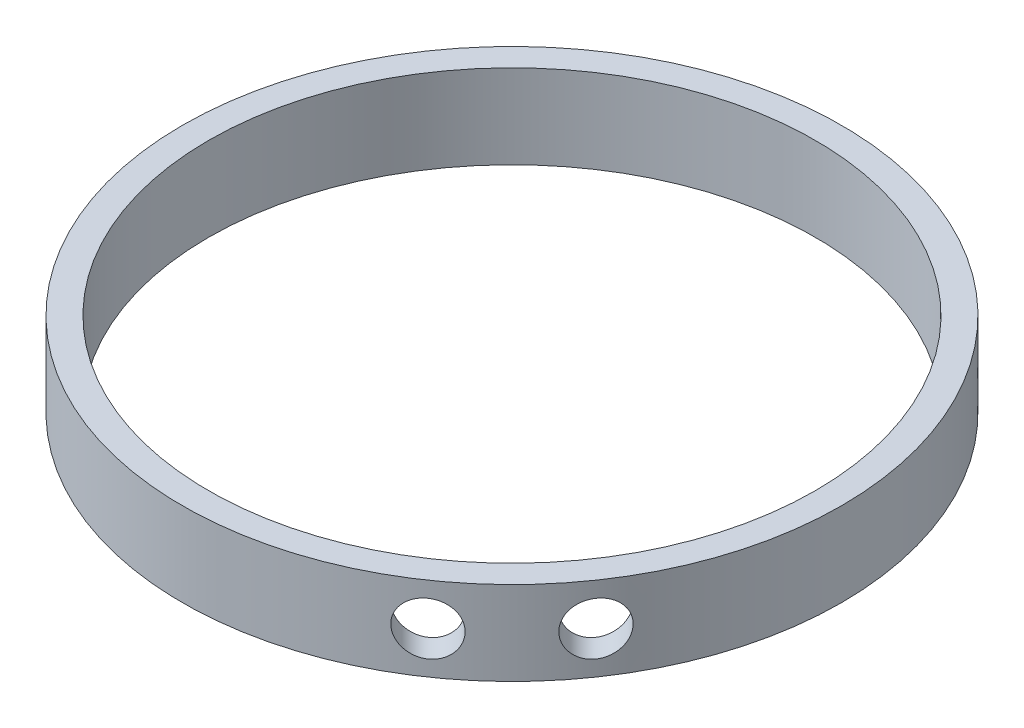
from build123d import *

# Parameters (mm, degrees)
SKETCH2_R                    = 7.9375
SKETCH2_R_2                  = 3.7465
BOSS_EXTRUDE1_DEPTH          = 204.47
FILLET1_R                    = 3.81
CIRPATTERN1_COUNT            = 4
FILLET1_OF_CIRPATTERN1_R     = 3.81
SKETCH3_R                    = 8.636
CUT_EXTRUDE1_DEPTH           = 12.7
CIRPATTERN2_COUNT            = 4
FILLET2_R                    = 2.54
MIRROR1_COPY_1_SKETCH_R      = 8.636
MIRROR1_COPY_1_DEPTH         = 12.7
MIRROR1_COPY_2_SKETCH_R      = 8.636
MIRROR1_COPY_2_DEPTH         = 12.7
MIRROR1_COPY_3_SKETCH_R      = 8.636
MIRROR1_COPY_3_DEPTH         = 12.7
FILLET3_R                    = 2.54
F_5_16_CLEARANCE_HOLE1_D     = 8.4328
F_5_16_CLEARANCE_HOLE1_DEPTH = 54.864
F_5_16_CLEARANCE_HOLE1_TIP   = 2.533468714
F_6_CLEARANCE_HOLE1_D        = 3.7973
F_6_CLEARANCE_HOLE1_DEPTH    = 54.864
F_6_CLEARANCE_HOLE1_TIP      = 1.140824014
CUT_EXTRUDE2_START           = -204.47
SKETCH9_R                    = 52.832
CUT_EXTRUDE2_DEPTH           = 95.504


with BuildPart() as part:
    # Sketch1 → Revolve1 (revolve)
    with BuildSketch(Plane.XY, mode=Mode.PRIVATE) as revolve1_sk:
        Polygon((44.45, 0), (44.45, 204.47), (50.6984, 204.47), (50.6984, 108.966), (52.832, 108.966), (52.832, 95.504), (50.6984, 95.504), (50.6984, 0), align=None)
    revolve(revolve1_sk.sketch.rotate(Axis((0, 138.931800571, 0), (0, -1, 0)), 180), axis=Axis((0, 138.931800571, 0), (0, -1, 0)))

    # Sketch2 → Boss-Extrude1 (add)
    with BuildSketch(Plane(origin=(0, 204.47, 0), x_dir=(1, 0, 0), z_dir=(0, 1, 0))):
        with Locations((0, 40.7035)):
            Circle(SKETCH2_R)
        with Locations(Location((0, 40.7035, 0), (0, 0, 180))):
            Circle(SKETCH2_R_2, mode=Mode.SUBTRACT)
    boss_extrude1 = extrude(amount=-BOSS_EXTRUDE1_DEPTH)

    # Fillet1
    fillet1_edges = [part.edges().sort_by_distance(p)[0] for p in [
        (-7.287865551, 102.235, -43.848483619),
        (7.287865551, 102.235, -43.848483619),
    ]]
    fillet(fillet1_edges, radius=FILLET1_R)

    # CirPattern1: Boss-Extrude1 ×4 about axis
    cirpattern1_axis = Axis((0, 0, 0), (0, 1, 0))
    for i in range(1, CIRPATTERN1_COUNT):
        add(boss_extrude1.rotate(cirpattern1_axis, i * 360 / CIRPATTERN1_COUNT))

    # Fillet1 of CirPattern1
    fillet1_of_cirpattern1_edges = [part.edges().sort_by_distance(p)[0] for p in [
        (-43.848483619, 102.235, 7.287865551),
        (-43.848483619, 102.235, -7.287865551),
        (7.287865551, 102.235, 43.848483619),
        (-7.287865551, 102.235, 43.848483619),
        (43.848483619, 102.235, -7.287865551),
        (43.848483619, 102.235, 7.287865551),
    ]]
    fillet(fillet1_of_cirpattern1_edges, radius=FILLET1_OF_CIRPATTERN1_R)

    # Sketch3 → Cut-Extrude1 (cut)
    with BuildSketch(Plane(origin=(0, 204.47, 0), x_dir=(1, 0, 0), z_dir=(0, 1, 0))):
        with Locations((0, 40.7035)):
            Circle(SKETCH3_R)
    cut_extrude1 = extrude(amount=-CUT_EXTRUDE1_DEPTH, mode=Mode.SUBTRACT)

    # CirPattern2: Cut-Extrude1 ×4 about axis
    cirpattern2_axis = Axis((0, 0, 0), (0, 1, 0))
    for i in range(1, CIRPATTERN2_COUNT):
        add(cut_extrude1.rotate(cirpattern2_axis, i * 360 / CIRPATTERN2_COUNT), mode=Mode.SUBTRACT)

    # Fillet2
    fillet2_edges = [part.edges().sort_by_distance(p)[0] for p in [
        (-8.61576795, 198.12, -41.294294914),
        (8.61576795, 198.12, -41.294294914),
        (-41.294294914, 198.12, 8.61576795),
        (8.61576795, 198.12, 41.294294914),
        (41.294294914, 198.12, -8.61576795),
        (41.294294914, 198.12, 8.61576795),
        (-8.61576795, 198.12, 41.294294914),
        (-41.294294914, 198.12, -8.61576795),
    ]]
    fillet(fillet2_edges, radius=FILLET2_R)

    # Mirror1: Cut-Extrude1 across plane
    add(cut_extrude1.mirror(Plane.ZX.offset(102.235)), mode=Mode.SUBTRACT)

    # Mirror1 copy 1 sketch → Mirror1 copy 1 (cut)
    with BuildSketch(Plane(origin=(0, 0, 0), x_dir=(0, 0, -1), z_dir=(0, -1, 0))):
        with Locations((0, -40.7035)):
            Circle(MIRROR1_COPY_1_SKETCH_R)
    extrude(amount=-MIRROR1_COPY_1_DEPTH, mode=Mode.SUBTRACT)

    # Mirror1 copy 2 sketch → Mirror1 copy 2 (cut)
    with BuildSketch(Plane(origin=(0, 0, 0), x_dir=(-1, 0, 0), z_dir=(0, -1, 0))):
        with Locations((0, -40.7035)):
            Circle(MIRROR1_COPY_2_SKETCH_R)
    extrude(amount=-MIRROR1_COPY_2_DEPTH, mode=Mode.SUBTRACT)

    # Mirror1 copy 3 sketch → Mirror1 copy 3 (cut)
    with BuildSketch(Plane(origin=(0, 0, 0), x_dir=(0, 0, 1), z_dir=(0, -1, 0))):
        with Locations((0, -40.7035)):
            Circle(MIRROR1_COPY_3_SKETCH_R)
    extrude(amount=-MIRROR1_COPY_3_DEPTH, mode=Mode.SUBTRACT)

    # Fillet3
    fillet3_edges = [part.edges().sort_by_distance(p)[0] for p in [
        (-41.294294914, 6.35, 8.61576795),
        (8.61576795, 6.35, 41.294294914),
        (41.294294914, 6.35, -8.61576795),
        (-8.61576795, 6.35, -41.294294914),
        (8.61576795, 6.35, -41.294294914),
        (41.294294914, 6.35, 8.61576795),
        (-8.61576795, 6.35, 41.294294914),
        (-41.294294914, 6.35, -8.61576795),
    ]]
    fillet(fillet3_edges, radius=FILLET3_R)

    # 5/16 Clearance Hole1
    with Locations(Plane(origin=(37.357865464, 0, 37.357865464), x_dir=(0, 1, 0), z_dir=(0.7071067811865488, 0, 0.7071067811865464))):
        with Locations((102.235, -9.525), (102.235, 9.525)):
            Hole(F_5_16_CLEARANCE_HOLE1_D / 2, depth=F_5_16_CLEARANCE_HOLE1_DEPTH)
            with Locations((0, 0, -(F_5_16_CLEARANCE_HOLE1_DEPTH + F_5_16_CLEARANCE_HOLE1_TIP / 2))):  # 118° drill point
                Cone(0, F_5_16_CLEARANCE_HOLE1_D / 2, F_5_16_CLEARANCE_HOLE1_TIP, mode=Mode.SUBTRACT)

    # #6 Clearance Hole1
    with Locations(Plane(origin=(37.357865464, 0, -37.357865464), x_dir=(0, 1, 0), z_dir=(0.7071067811865438, 0, -0.7071067811865512))):
        with Locations((102.235, 0)):
            Hole(F_6_CLEARANCE_HOLE1_D / 2, depth=F_6_CLEARANCE_HOLE1_DEPTH)
            with Locations((0, 0, -(F_6_CLEARANCE_HOLE1_DEPTH + F_6_CLEARANCE_HOLE1_TIP / 2))):  # 118° drill point
                Cone(0, F_6_CLEARANCE_HOLE1_D / 2, F_6_CLEARANCE_HOLE1_TIP, mode=Mode.SUBTRACT)

    # Sketch9 → Cut-Extrude2 (cut)
    with BuildSketch(Plane(origin=(0, 204.47, 0), x_dir=(1, 0, 0), z_dir=(0, 1, 0)).offset(CUT_EXTRUDE2_START)):
        with Locations(Location((0, 0, 0), (0, 0, 180))):
            Circle(SKETCH9_R)
    extrude(amount=CUT_EXTRUDE2_DEPTH, mode=Mode.SUBTRACT)

    # Sketch11 → Cut-Revolve2 (revolve, cut)
    with BuildSketch(Plane.XY):
        Polygon((48.641, 95.504), (0, 95.504), (0, 204.47), (50.6984, 204.47), (50.6984, 108.966), (48.641, 108.966), align=None)
    revolve(axis=Axis((0, 95.504, 0), (0, 1, 0)), mode=Mode.SUBTRACT)


solid = part.part
